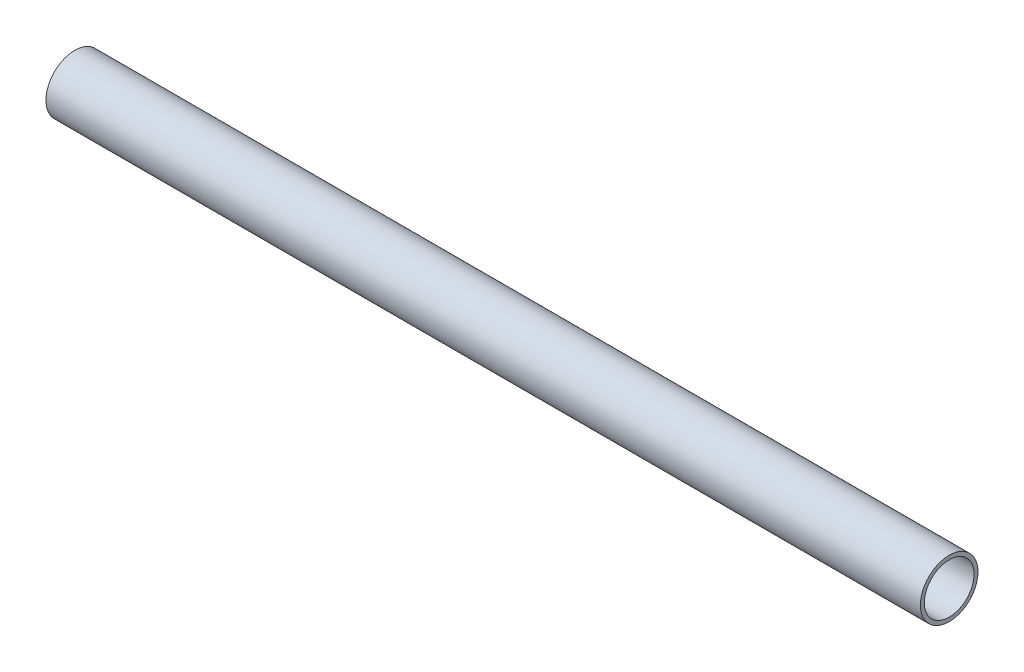
from build123d import *

# Parameters (mm, degrees)
BOSS_EXTRUDE1_DEPTH      = 24
BOSS_EXTRUDE1_DEPTH_BACK = 310
SKETCH1_R                = 11
SKETCH1_R_2              = 9.5


with BuildPart() as part:
    # Sketch1 → Boss-Extrude1 (new, two sides: drawn at the far end of the back side and taken through both)
    with BuildSketch(Plane(origin=(0, 0, 0), x_dir=(0, 0, -1), z_dir=(1, 0, 0)).offset(-BOSS_EXTRUDE1_DEPTH_BACK)):
        Circle(SKETCH1_R)
        Circle(SKETCH1_R_2, mode=Mode.SUBTRACT)
    extrude(amount=BOSS_EXTRUDE1_DEPTH + BOSS_EXTRUDE1_DEPTH_BACK)


solid = part.part
